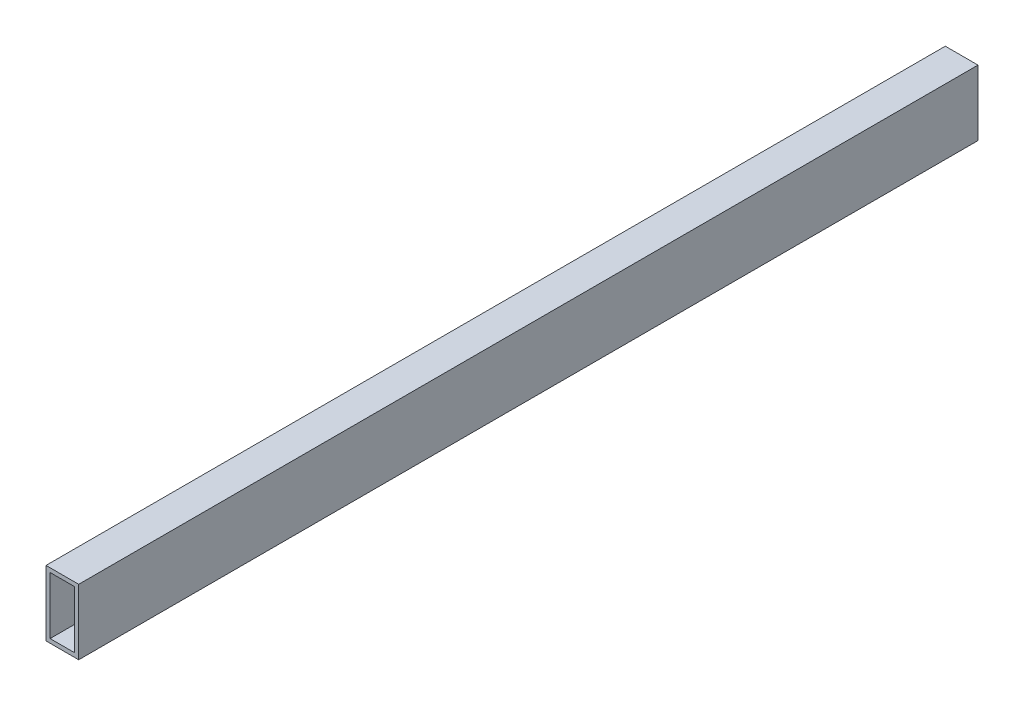
from build123d import *

# Parameters (mm, degrees)
SKETCH1_W           = 25.4
SKETCH1_H           = 50.8
SKETCH1_W_2         = 19.05
SKETCH1_H_2         = 44.45
BOSS_EXTRUDE1_DEPTH = 349.25


with BuildPart() as part:
    # Sketch1 → Boss-Extrude1 (new, symmetric)
    with BuildSketch(Plane.XY):
        Rectangle(SKETCH1_W, SKETCH1_H)
        Rectangle(SKETCH1_W_2, SKETCH1_H_2, mode=Mode.SUBTRACT)
    extrude(amount=BOSS_EXTRUDE1_DEPTH, both=True)


solid = part.part
